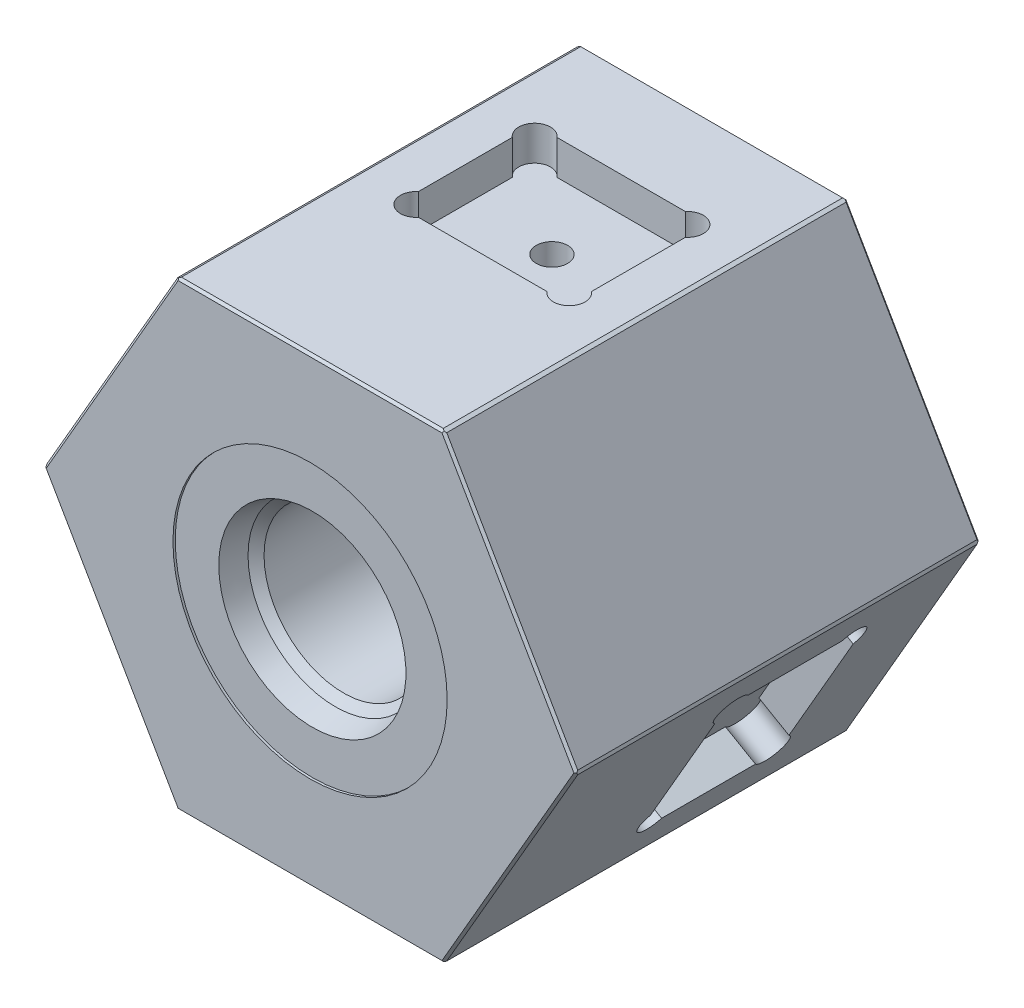
from build123d import *

# Parameters (mm, degrees)
SKETCH1_R                 = 8.255
BOSS_EXTRUDE1_DEPTH       = 44.45
CHAMFER1_SIZE             = 0.254
CHAMFER2_SIZE             = 0.254
CUT_EXTRUDE16_DEPTH       = 3.81
CIRPATTERN3_COUNT         = 3
CIRPATTERN4_COUNT         = 2
CIRPATTERN4_ANGLE         = 120
CIRPATTERN5_COUNT         = 3
CIRPATTERN6_COUNT         = 2
CIRPATTERN6_ANGLE         = 60
CIRPATTERN7_COUNT         = 2
F_6_32_TAPPED_HOLE2_D     = 2.7051
F_6_32_TAPPED_HOLE2_DEPTH = 6.35
F_6_32_TAPPED_HOLE2_TIP   = 0.81269403
BOSS_EXTRUDE2_DEPTH       = 1.27
CHAMFER3_SIZE             = 0.254
CHAMFER3_EDGE_2_SIZE      = 0.254
CHAMFER3_EDGE_3_SIZE      = 0.254
CHAMFER3_EDGE_4_SIZE      = 0.254
CHAMFER3_EDGE_5_SIZE      = 0.254
CHAMFER3_EDGE_6_SIZE      = 0.254
SKETCH60_R                = 1.74625
CUT_EXTRUDE17_DEPTH       = 3.81
MIRROR2_COPY_1_SKETCH_R   = 1.74625
MIRROR2_COPY_1_DEPTH      = 3.81
SKETCH61_R                = 1.74625
CUT_EXTRUDE18_DEPTH       = 3.81
MIRROR4_COPY_1_SKETCH_R   = 1.74625
MIRROR4_COPY_1_DEPTH      = 3.81
SKETCH62_R                = 1.74625
CUT_EXTRUDE19_DEPTH       = 3.81
MIRROR6_COPY_1_SKETCH_R   = 1.74625
MIRROR6_COPY_1_DEPTH      = 3.81


with BuildPart() as part:
    # Sketch1 → Boss-Extrude1 (new body)
    with BuildSketch(Plane.XY):
        Polygon((29.329393675, 0), (14.664696837, 25.4), (-14.664696837, 25.4), (-29.329393675, 0), (-14.664696837, -25.4), (14.664696837, -25.4), align=None)
        Circle(SKETCH1_R, mode=Mode.SUBTRACT)
    extrude(amount=BOSS_EXTRUDE1_DEPTH)

    # Chamfer1
    chamfer1_edges = [part.edges().sort_by_distance(p)[0] for p in [
        (0, 25.4, 44.45),
        (-21.997045256, 12.7, 44.45),
        (-21.997045256, -12.7, 44.45),
        (0, -25.4, 44.45),
        (21.997045256, -12.7, 44.45),
        (21.997045256, 12.7, 44.45),
    ]]
    chamfer(chamfer1_edges, length=CHAMFER1_SIZE)

    # Chamfer2
    chamfer2_edges = [part.edges().sort_by_distance(p)[0] for p in [
        (0, -25.4, 0),
        (-21.997045256, -12.7, 0),
        (-21.997045256, 12.7, 0),
        (0, 25.4, 0),
        (21.997045256, 12.7, 0),
        (21.997045256, -12.7, 0),
    ]]
    chamfer(chamfer2_edges, length=CHAMFER2_SIZE)

    # Sketch42 → Cut-Extrude16 (cut)
    with BuildSketch(Plane(origin=(0, 25.4, 0), x_dir=(1, 0, 0), z_dir=(0, 1, 0))):
        with BuildLine():
            Line((-7.62, -10.2108), (7.62, -10.2108))
            ThreePointArc((7.62, -10.2108), (8.967038418, -10.768761582), (9.525, -12.1158))
            Line((9.525, -12.1158), (9.525, -23.5458))
            ThreePointArc((9.525, -23.5458), (8.967038418, -24.892838418), (7.62, -25.4508))
            Line((7.62, -25.4508), (-7.62, -25.4508))
            ThreePointArc((-7.62, -25.4508), (-8.967038418, -24.892838418), (-9.525, -23.5458))
            Line((-9.525, -23.5458), (-9.525, -12.1158))
            ThreePointArc((-9.525, -12.1158), (-8.967038418, -10.768761582), (-7.62, -10.2108))
        make_face()
    cut_extrude16 = extrude(amount=-CUT_EXTRUDE16_DEPTH, mode=Mode.SUBTRACT)

    # Sketch43 → Cut-Revolve1 (revolve, cut)
    with BuildSketch(Plane(origin=(0, 0, 0), x_dir=(1, 0, 0), z_dir=(0, 1, 0)), mode=Mode.PRIVATE) as cut_revolve1_sk:
        Polygon((10.2997, -44.196), (9.619109051, -41.656), (8.7376, -40.774490949), (8.7376, -23.299290949), (4.9657, -21.121583468), (0, -21.121583468), (0, -44.45), (15.0876, -44.45), (15.0876, -44.196), align=None)
    revolve(cut_revolve1_sk.sketch.rotate(Axis((0, 0, 44.45), (0, 0, 1)), 180), axis=Axis((0, 0, 44.45), (0, 0, 1)), mode=Mode.SUBTRACT)

    # CirPattern3: Cut-Extrude16 ×3 about axis
    cirpattern3_axis = Axis((0, 0, 0), (0, 0, 1))
    for i in range(1, CIRPATTERN3_COUNT):
        add(cut_extrude16.rotate(cirpattern3_axis, i * 360 / CIRPATTERN3_COUNT), mode=Mode.SUBTRACT)

    # Sketch44 → Cut-Revolve2 (revolve, cut)
    with BuildSketch(Plane.XY.offset(12.7), mode=Mode.PRIVATE) as cut_revolve2_sk:
        Polygon((-24.856484742, 7.209190797), (-22.559708978, 6.462923113), (-21.493391064, 6.748642137), (-12.182750987, 1.373141582), (-9.464950987, 2.942264144), (-2.86583741, -0.867735856), (-1.77363741, 1.024010036), (-21.764034742, 12.565471317), (-21.997045256, 12.7), (-27.254845256, 3.593223264), (-27.021834742, 3.458694581), align=None)
    cut_revolve2 = revolve(cut_revolve2_sk.sketch.rotate(Axis((-1.77363741, 1.024010036, 12.7), (-0.8660254037844387, 0.5, 0)), 180), axis=Axis((-1.77363741, 1.024010036, 12.7), (-0.8660254037844387, 0.5, 0)), mode=Mode.SUBTRACT)

    # CirPattern4: Cut-Revolve2 ×2 about axis
    cirpattern4_axis = Axis((0, 0, 0), (0, 0, 1))
    for i in range(1, CIRPATTERN4_COUNT):
        add(cut_revolve2.rotate(cirpattern4_axis, i * CIRPATTERN4_ANGLE / (CIRPATTERN4_COUNT - 1)), mode=Mode.SUBTRACT)

    # Sketch47 → #8-32 Tapped Hole1 (revolve, cut)
    with BuildSketch(Plane(origin=(-18.697488468, -10.795, 17.8308), x_dir=(0.5000000000000042, -0.8660254037844362, 0), z_dir=(0, 0, 1))):
        Polygon((0, 0), (0, 11.197806461), (1.7272, 10.16), (1.7272, 0), align=None)
    f_8_32_tapped_hole1 = revolve(axis=Axis((-24.196749782, -13.97, 17.8308), (0.8660254037844362, 0.5000000000000042, 0)), mode=Mode.SUBTRACT)

    # CirPattern5: #8-32 Tapped Hole1 ×3 about axis
    cirpattern5_axis = Axis((0, 0, 0), (0, 0, 1))
    for i in range(1, CIRPATTERN5_COUNT):
        add(f_8_32_tapped_hole1.rotate(cirpattern5_axis, i * 360 / CIRPATTERN5_COUNT), mode=Mode.SUBTRACT)

    # Sketch49 → Revolve1 (revolve)
    with BuildSketch(Plane(origin=(0, 0, 0), x_dir=(0, 0, -1), z_dir=(1, 0, 0)), mode=Mode.PRIVATE) as revolve1_sk:
        Polygon((0, 23.622), (0, 8.255), (5.842, 8.255), (5.842, 10.6172), (4.5466, 10.6172), (4.5466, 12.7508), (5.842, 12.7508), (5.842, 14.605), (2.667, 14.605), (2.667, 15.84325), (0.381, 15.84325), (0.381, 23.622), align=None)
    revolve(revolve1_sk.sketch.rotate(Axis((0, 0, 0), (0, 0, -1)), 90), axis=Axis((0, 0, 0), (0, 0, -1)))

    # Sketch25 → #6-32 Tapped Hole1 (revolve, cut)
    with BuildSketch(Plane(origin=(-20.32, 0, -0.381), x_dir=(0, 1, 0), z_dir=(1, 0, 0))):
        Polygon((0, 0), (0, 7.16269403), (1.35255, 6.35), (1.35255, 0), align=None)
    f_6_32_tapped_hole1 = revolve(axis=Axis((-20.32, 0, -6.731), (0, 0, 1)), mode=Mode.SUBTRACT)

    # CirPattern6: #6-32 Tapped Hole1 ×2 about axis
    cirpattern6_axis = Axis((0, 0, -5.842), (0, 0, 1))
    for i in range(1, CIRPATTERN6_COUNT):
        add(f_6_32_tapped_hole1.rotate(cirpattern6_axis, i * CIRPATTERN6_ANGLE / (CIRPATTERN6_COUNT - 1)), mode=Mode.SUBTRACT)

    # CirPattern7: #6-32 Tapped Hole1 ×2 about axis
    cirpattern7_axis = Axis((0, 0, 0), (0, 0, 1))
    for i in range(1, CIRPATTERN7_COUNT):
        add(f_6_32_tapped_hole1.rotate(cirpattern7_axis, i * 360 / CIRPATTERN7_COUNT), mode=Mode.SUBTRACT)

    # CirPattern7 copy 1 sketch → CirPattern7 copy 1 (revolve, cut)
    with BuildSketch(Plane(origin=(10.16, 17.597636205, -0.381), x_dir=(0.8660254037844397, -0.4999999999999981, 0), z_dir=(-0.4999999999999981, -0.8660254037844397, 0))):
        Polygon((0, 0), (0, 7.16269403), (1.35255, 6.35), (1.35255, 0), align=None)
    revolve(axis=Axis((10.16, 17.597636205, -6.731), (0, 0, 1)), mode=Mode.SUBTRACT)

    # #6-32 Tapped Hole2
    with Locations(Plane(origin=(0, 0, -0.381), x_dir=(-1, 0, 0), z_dir=(0, 0, -1))):
        with Locations((15.566023084, 13.061444229), (3.52853097, 20.011293541), (-15.566023084, -13.061444229), (-3.52853097, -20.011293541)):
            Hole(F_6_32_TAPPED_HOLE2_D / 2, depth=F_6_32_TAPPED_HOLE2_DEPTH)
            with Locations((0, 0, -(F_6_32_TAPPED_HOLE2_DEPTH + F_6_32_TAPPED_HOLE2_TIP / 2))):  # 118° drill point
                Cone(0, F_6_32_TAPPED_HOLE2_D / 2, F_6_32_TAPPED_HOLE2_TIP, mode=Mode.SUBTRACT)

    # Sketch50 → Boss-Extrude2 (add)
    with BuildSketch(Plane(origin=(0, 0, -0.381), x_dir=(-1, 0, 0), z_dir=(0, 0, -1))):
        with BuildLine():
            Line((16.508829575, -10.440588403), (17.296229575, -9.076771597))
            ThreePointArc((17.296229575, -9.076771597), (18.392656205, -8.782984967), (18.686442835, -9.879411597))
            Line((18.686442835, -9.879411597), (17.899042835, -11.243228403))
            ThreePointArc((17.899042835, -11.243228403), (16.802616205, -11.537015033), (16.508829575, -10.440588403))
        make_face()
    extrude(amount=BOSS_EXTRUDE2_DEPTH)

    # Chamfer3
    chamfer3_edges = [part.edges().sort_by_distance(p)[0] for p in [
        (14.664696837, -25.4, 22.225),
    ]]
    chamfer(chamfer3_edges, length=CHAMFER3_SIZE)

    # Chamfer3 edge 2
    chamfer3_edge_2_edges = [part.edges().sort_by_distance(p)[0] for p in [
        (-14.664696837, -25.4, 22.225),
    ]]
    chamfer(chamfer3_edge_2_edges, length=CHAMFER3_EDGE_2_SIZE)

    # Chamfer3 edge 3
    chamfer3_edge_3_edges = [part.edges().sort_by_distance(p)[0] for p in [
        (-29.329393675, 0, 22.225),
    ]]
    chamfer(chamfer3_edge_3_edges, length=CHAMFER3_EDGE_3_SIZE)

    # Chamfer3 edge 4
    chamfer3_edge_4_edges = [part.edges().sort_by_distance(p)[0] for p in [
        (-14.664696837, 25.4, 22.225),
    ]]
    chamfer(chamfer3_edge_4_edges, length=CHAMFER3_EDGE_4_SIZE)

    # Chamfer3 edge 5
    chamfer3_edge_5_edges = [part.edges().sort_by_distance(p)[0] for p in [
        (14.664696837, 25.4, 22.225),
    ]]
    chamfer(chamfer3_edge_5_edges, length=CHAMFER3_EDGE_5_SIZE)

    # Chamfer3 edge 6
    chamfer3_edge_6_edges = [part.edges().sort_by_distance(p)[0] for p in [
        (29.329393675, 0, 22.225),
    ]]
    chamfer(chamfer3_edge_6_edges, length=CHAMFER3_EDGE_6_SIZE)

    # Sketch60 → Cut-Extrude17 (cut)
    with BuildSketch(Plane(origin=(0, 25.4, 0), x_dir=(1, 0, 0), z_dir=(0, 1, 0))):
        with Locations((-8.413693305, -11.322106695)):
            Circle(SKETCH60_R)
    cut_extrude17 = extrude(amount=-CUT_EXTRUDE17_DEPTH, mode=Mode.SUBTRACT)

    # Mirror1: Cut-Extrude17 across plane
    add(cut_extrude17.mirror(Plane(origin=(0, 0, 0), x_dir=(0, 0, 1), z_dir=(1, 0, 0))), mode=Mode.SUBTRACT)

    # Mirror2: Cut-Extrude17 across plane
    add(cut_extrude17.mirror(Plane.XY.offset(17.8308)), mode=Mode.SUBTRACT)

    # Mirror2 copy 1 sketch → Mirror2 copy 1 (cut)
    with BuildSketch(Plane(origin=(0, 25.4, 35.6616), x_dir=(-1, 0, 0), z_dir=(0, 1, 0))):
        with Locations((-8.413693305, -11.322106695)):
            Circle(MIRROR2_COPY_1_SKETCH_R)
    extrude(amount=-MIRROR2_COPY_1_DEPTH, mode=Mode.SUBTRACT)

    # Sketch61 → Cut-Extrude18 (cut)
    with BuildSketch(Plane(origin=(-21.997045256, -12.7, 0), x_dir=(0, 0, 1), z_dir=(-0.8660254037844388, -0.49999999999999967, 0))):
        with Locations((24.339493305, 8.413693305)):
            Circle(SKETCH61_R)
    cut_extrude18 = extrude(amount=-CUT_EXTRUDE18_DEPTH, mode=Mode.SUBTRACT)

    # Mirror3: Cut-Extrude18 across plane
    add(cut_extrude18.mirror(Plane(origin=(0, 0, 0), x_dir=(0, 0, 1), z_dir=(0.5000000000000041, -0.8660254037844364, 0))), mode=Mode.SUBTRACT)

    # Mirror4: Cut-Extrude18 across plane
    add(cut_extrude18.mirror(Plane(origin=(0, 0, 17.8308), x_dir=(1, 0, 0), z_dir=(0, 0, -1))), mode=Mode.SUBTRACT)

    # Mirror4 copy 1 sketch → Mirror4 copy 1 (cut)
    with BuildSketch(Plane(origin=(-21.997045256, -12.7, 35.6616), x_dir=(0, 0, -1), z_dir=(-0.8660254037844337, -0.5000000000000084, 0))):
        with Locations((24.339493305, 8.413693305)):
            Circle(MIRROR4_COPY_1_SKETCH_R)
    extrude(amount=-MIRROR4_COPY_1_DEPTH, mode=Mode.SUBTRACT)

    # Sketch62 → Cut-Extrude19 (cut)
    with BuildSketch(Plane(origin=(21.997045256, -12.7, 0), x_dir=(0, 0, -1), z_dir=(0.8660254037844389, -0.49999999999999983, 0))):
        with Locations((-24.339493305, -8.413693305)):
            Circle(SKETCH62_R)
    cut_extrude19 = extrude(amount=-CUT_EXTRUDE19_DEPTH, mode=Mode.SUBTRACT)

    # Mirror5: Cut-Extrude19 across plane
    add(cut_extrude19.mirror(Plane(origin=(0, 0, 0), x_dir=(0, 0, 1), z_dir=(0.49999999999999195, 0.8660254037844434, 0))), mode=Mode.SUBTRACT)

    # Mirror6: Cut-Extrude19 across plane
    add(cut_extrude19.mirror(Plane(origin=(0, 0, 17.8308), x_dir=(1, 0, 0), z_dir=(0, 0, -1))), mode=Mode.SUBTRACT)

    # Mirror6 copy 1 sketch → Mirror6 copy 1 (cut)
    with BuildSketch(Plane(origin=(21.997045256, -12.7, 35.6616), x_dir=(0, 0, 1), z_dir=(0.8660254037844479, -0.4999999999999841, 0))):
        with Locations((-24.339493305, -8.413693305)):
            Circle(MIRROR6_COPY_1_SKETCH_R)
    extrude(amount=-MIRROR6_COPY_1_DEPTH, mode=Mode.SUBTRACT)


solid = part.part
